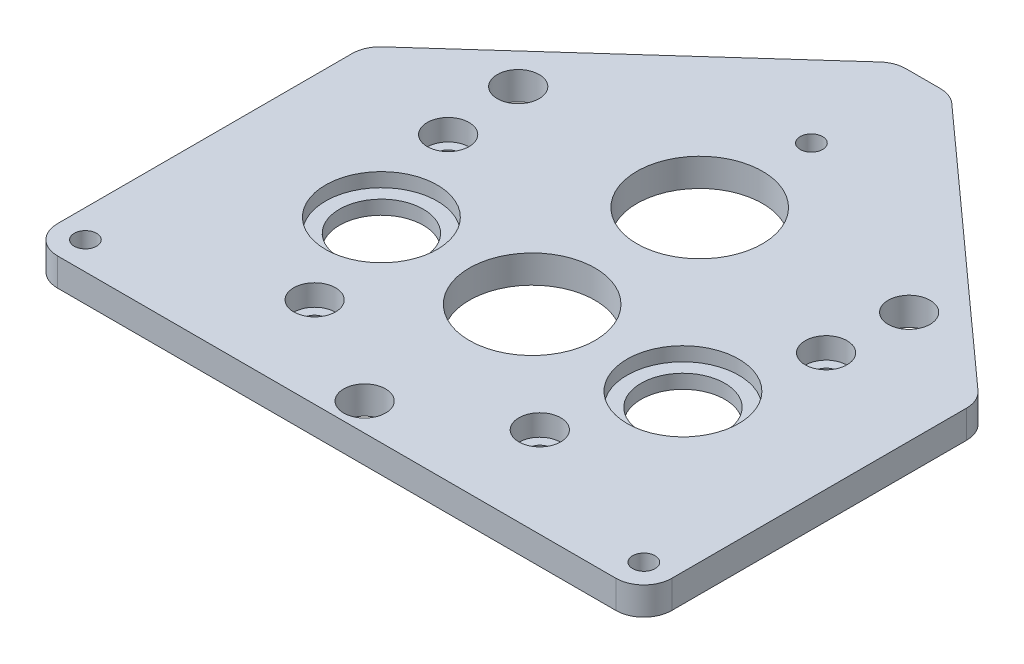
from build123d import *

# Parameters (mm, degrees)
BOSS_EXTRUDE1_DEPTH                             = 6.35
SKETCH2_R                                       = 9.525
MOTOR_SHAFT_HOLES_DEPTH                         = 135.10382172
SKETCH3_R                                       = 14.2875
FIRST_BEARING_HOLE_DEPTH                        = 135.10382172
SKETCH4_R                                       = 12.7
PINION_CLEARANCE_DEPTH                          = 3.175
SKETCH5_R                                       = 14.2875
CUT_EXTRUDE1_DEPTH                              = 135.10382172
CBORE_FOR_10_SOCKET_HEAD_CAP_SCREW1_D           = 5.1054
CBORE_FOR_10_SOCKET_HEAD_CAP_SCREW1_CBORE_D     = 9.525
CBORE_FOR_10_SOCKET_HEAD_CAP_SCREW1_CBORE_DEPTH = 4.826
F_10_CLEARANCE_HOLE1_D                          = 5.1054
FILLET1_R                                       = 6.35
SKETCH11_R                                      = 4.7625
CUT_EXTRUDE2_DEPTH                              = 50.8


with BuildPart() as part:
    # Sketch1 → Boss-Extrude1 (new body)
    with BuildSketch(Plane(origin=(0, 0, 0), x_dir=(1, 0, 0), z_dir=(0, 1, 0))):
        Polygon((69.85, -19.05), (69.85, 57.15), (6.35, 114.3), (-6.35, 114.3), (-69.85, 57.15), (-69.85, -19.05), align=None)
    extrude(amount=BOSS_EXTRUDE1_DEPTH)

    # Sketch2 → Motor Shaft Holes (cut, through all)
    with BuildSketch(Plane(origin=(0, 6.35, 0), x_dir=(1, 0, 0), z_dir=(0, 1, 0))):
        with Locations(Location((-34.29, 25.4, 0), (0, 0, 270))):
            Circle(SKETCH2_R)
        with Locations(Location((34.29, 25.4, 0), (0, 0, 270))):
            Circle(SKETCH2_R)
    extrude(amount=-MOTOR_SHAFT_HOLES_DEPTH, mode=Mode.SUBTRACT)

    # Sketch3 → First Bearing Hole (cut, through all)
    with BuildSketch(Plane(origin=(0, 6.35, 0), x_dir=(1, 0, 0), z_dir=(0, 1, 0))):
        with Locations(Location((0, 25.4, 0), (0, 0, 270))):
            Circle(SKETCH3_R)
    extrude(amount=-FIRST_BEARING_HOLE_DEPTH, mode=Mode.SUBTRACT)

    # Sketch4 → Pinion Clearance (cut)
    with BuildSketch(Plane(origin=(0, 6.35, 0), x_dir=(1, 0, 0), z_dir=(0, 1, 0))):
        with Locations(Location((-34.29, 25.4, 0), (0, 0, 270))):
            Circle(SKETCH4_R)
        with Locations(Location((34.29, 25.4, 0), (0, 0, 270))):
            Circle(SKETCH4_R)
    extrude(amount=-PINION_CLEARANCE_DEPTH, mode=Mode.SUBTRACT)

    # Sketch5 → Cut-Extrude1 (cut, through all)
    with BuildSketch(Plane(origin=(0, 6.35, 0), x_dir=(1, 0, 0), z_dir=(0, 1, 0))):
        with Locations(Location((0, 63.5, 0), (0, 0, 270))):
            Circle(SKETCH5_R)
    extrude(amount=-CUT_EXTRUDE1_DEPTH, mode=Mode.SUBTRACT)

    # CBORE for #10 Socket Head Cap Screw1 (through all)
    with Locations(Plane(origin=(0, 6.35, 0), x_dir=(1, 0, 0), z_dir=(0, 1, 0))):
        with Locations((-42.97731164, 49.268192568), (-25.60268836, 1.531807432)):
            cbore_for_10_socket_head_cap_screw1 = CounterBoreHole(CBORE_FOR_10_SOCKET_HEAD_CAP_SCREW1_D / 2, CBORE_FOR_10_SOCKET_HEAD_CAP_SCREW1_CBORE_D / 2, CBORE_FOR_10_SOCKET_HEAD_CAP_SCREW1_CBORE_DEPTH)

    # Mirror1: CBORE for #10 Socket Head Cap Screw1 across plane
    add(cbore_for_10_socket_head_cap_screw1.mirror(Plane(origin=(0, 0, 0), x_dir=(0, 0, 1), z_dir=(1, 0, 0))), mode=Mode.SUBTRACT)

    # #10 Clearance Hole1 (through all)
    with Locations(Plane(origin=(0, 34.925, 19.05), x_dir=(1, 0, 0), z_dir=(0, 1, 0))):
        with Locations((-63.5, 6.35), (63.5, 6.35), (0, 107.95)):
            Hole(F_10_CLEARANCE_HOLE1_D / 2)

    # Fillet1
    fillet1_edges = [part.edges().sort_by_distance(p)[0] for p in [
        (69.85, 3.175, -57.15),
        (69.85, 3.175, 19.05),
        (-69.85, 3.175, 19.05),
        (-69.85, 3.175, -57.15),
        (-6.35, 3.175, -114.3),
        (6.35, 3.175, -114.3),
    ]]
    fillet(fillet1_edges, radius=FILLET1_R)

    # Sketch11 → Cut-Extrude2 (cut)
    with BuildSketch(Plane(origin=(0, 0, 19.05), x_dir=(-1, 0, 0), z_dir=(0, -1, 0))):
        with Locations(Location((-44.45, 85.725, 0), (0, 0, 90))):
            Circle(SKETCH11_R)
        with Locations(Location((44.45, 85.725, 0), (0, 0, 90))):
            Circle(SKETCH11_R)
        with Locations(Location((0, 6.35, 0), (0, 0, 90))):
            Circle(SKETCH11_R)
    extrude(amount=-CUT_EXTRUDE2_DEPTH, mode=Mode.SUBTRACT)


solid = part.part
